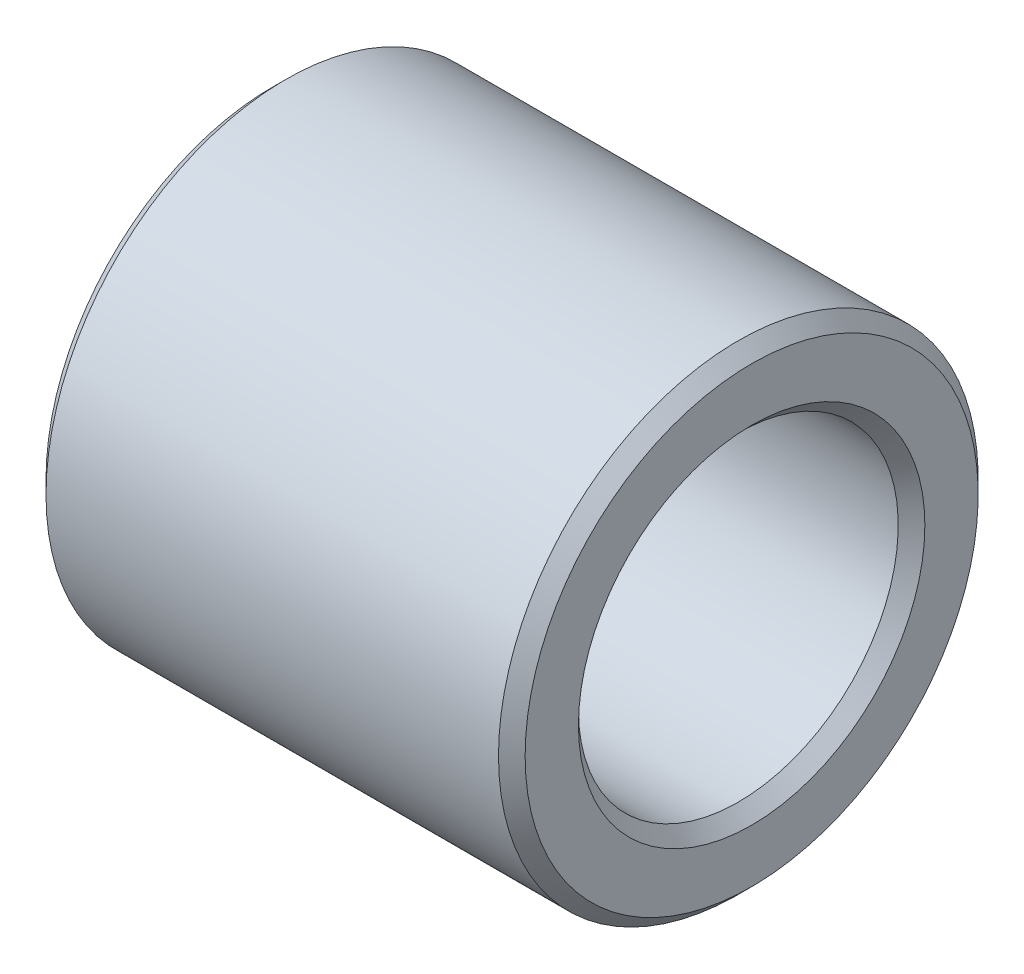
from build123d import *


with BuildPart() as part:
    # Esquisse1 → Révolution1 (revolve)
    with BuildSketch(Plane.XY, mode=Mode.PRIVATE) as r_volution1_sk:
        Polygon((0, 8.5), (0.5, 9), (17.48, 9), (17.98, 8.5), (17.98, 6.5), (17.48, 6), (0.5, 6), (0, 6.5), align=None)
    revolve(r_volution1_sk.sketch.rotate(Axis((-10.655084746, 0, 0), (1, 0, 0)), 90), axis=Axis((-10.655084746, 0, 0), (1, 0, 0)))


solid = part.part
